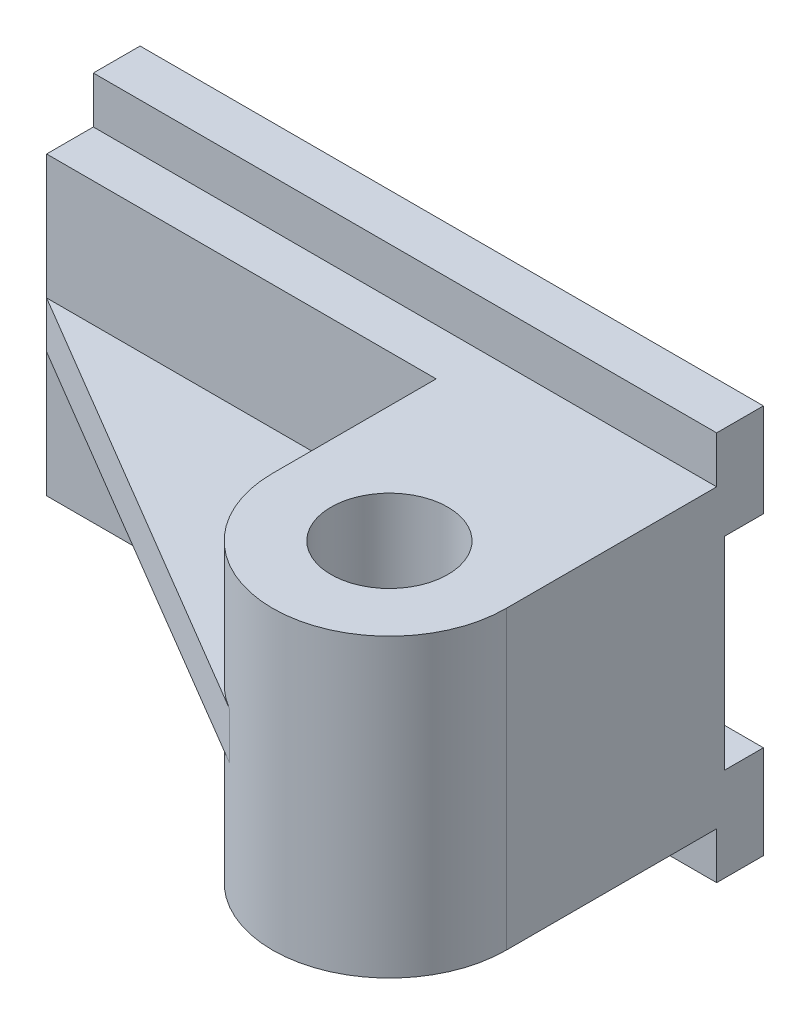
from build123d import *

# Parameters (mm, degrees)
SKETCH1_W               = 160
SKETCH1_H               = 100
BOSS_EXTRUDE1_DEPTH     = 12
SKETCH2_W               = 160
SKETCH2_H               = 76
BOSS_EXTRUDE2_DEPTH     = 12
CUT_EXTRUDE3_DEPTH      = 169.059513268
CUT_EXTRUDE3_DEPTH_BACK = 169.059513268
BOSS_EXTRUDE3_DEPTH     = 76
CUT_EXTRUDE4_DEPTH      = 146.602197786
CUT_EXTRUDE4_DEPTH_BACK = 146.602197786
SKETCH6_R               = 15
RIB1_REACH              = 128.317
SKETCH7_WALL_W          = 387.915779446
SKETCH7_WALL_H          = 12


with BuildPart() as part:
    # Sketch1 → Boss-Extrude1 (new body)
    with BuildSketch(Plane.XY):
        Rectangle(SKETCH1_W, SKETCH1_H)
    extrude(amount=-BOSS_EXTRUDE1_DEPTH)

    # Sketch2 → Boss-Extrude2 (add)
    with BuildSketch(Plane.XY):
        Rectangle(SKETCH2_W, SKETCH2_H)
    extrude(amount=BOSS_EXTRUDE2_DEPTH)

    # Sketch3 → Cut-Extrude3 (cut, two sides: drawn at the far end of the back side and taken through both)
    with BuildSketch(Plane.ZY.offset(80).offset(-CUT_EXTRUDE3_DEPTH_BACK)):
        Polygon((-181.398870761, 26), (-12, 26), (-2, 26), (-2, -26), (-12, -26), (-181.398870761, -26), (-520.196612284, -26), (-520.196612284, 26), align=None)
    extrude(amount=CUT_EXTRUDE3_DEPTH + CUT_EXTRUDE3_DEPTH_BACK, mode=Mode.SUBTRACT)

    # Sketch5 → Boss-Extrude3 (add)
    with BuildSketch(Plane.XZ.offset(38)):
        with BuildLine():
            Line((20, 12), (80, 12))
            Line((80, 12), (80, 54))
            ThreePointArc((80, 54), (50, 24), (20, 54))
            Line((20, 54), (20, 12))
        make_face()
        with BuildLine():
            ThreePointArc((20, 54), (50, 24), (80, 54))
            Line((80, 54), (20, 54))
        make_face()
        with BuildLine():
            Line((20, 54), (80, 54))
            ThreePointArc((80, 54), (50, 84), (20, 54))
        make_face()
    extrude(amount=-BOSS_EXTRUDE3_DEPTH)

    # Sketch6 → Cut-Extrude4 (cut, two sides: drawn at the far end of the back side and taken through both)
    with BuildSketch(Plane.XZ.offset(38).offset(-CUT_EXTRUDE4_DEPTH_BACK)):
        with Locations(Location((50, 54, 0), (0, 0, 270))):
            Circle(SKETCH6_R)
    extrude(amount=CUT_EXTRUDE4_DEPTH + CUT_EXTRUDE4_DEPTH_BACK, mode=Mode.SUBTRACT)

    # Sketch7 wall → Rib1 (add, up to next)
    with BuildSketch(Plane(origin=(-22.633274951, 0, 45.912517706), x_dir=(0.860834513758, 0, 0.508884996756), z_dir=(0.508884996756, 0, -0.860834513758)), mode=Mode.PRIVATE) as rib1_sk1:
        Rectangle(SKETCH7_WALL_W, SKETCH7_WALL_H)
    rib1_tool1 = extrude(rib1_sk1.sketch, amount=RIB1_REACH, mode=Mode.PRIVATE) - part.part
    add(rib1_tool1.solids().sort_by_distance((-22.633274951, 0, 45.912517706))[0])


solid = part.part
